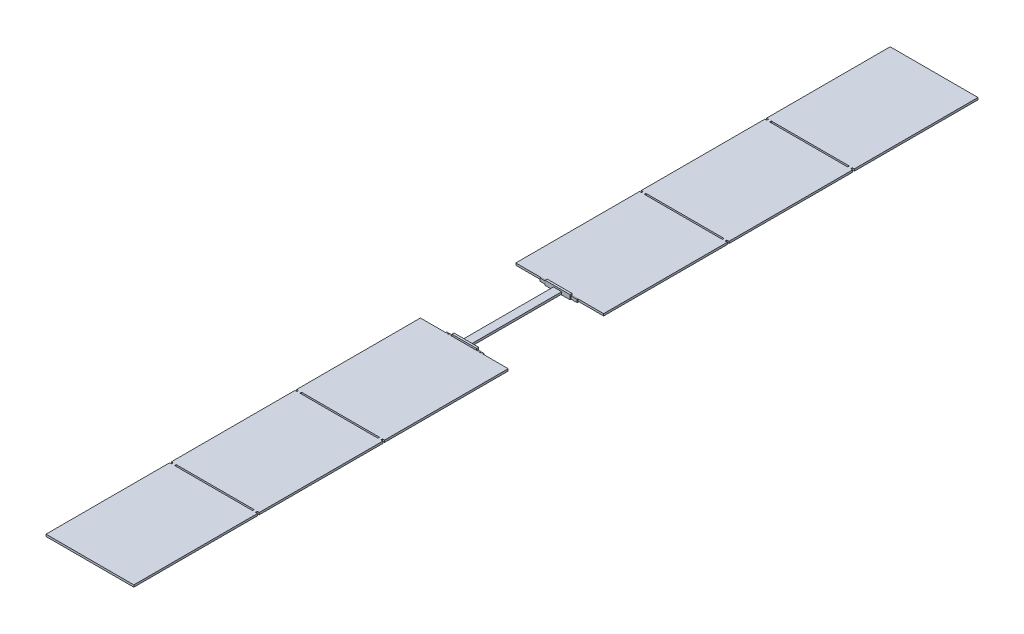
from build123d import *

# Parameters (mm, degrees)
ESTRUSIONE_ESTRUSIONE2_DEPTH      = 150
ESTRUSIONE_ESTRUSIONE2_DEPTH_BACK = 150
ESTRUSIONE_ESTRUSIONE3_DEPTH      = 3.3
ESTRUSIONE_ESTRUSIONE3_DEPTH_BACK = 303.3
SCHIZZO3_W                        = 6.5
SCHIZZO3_H                        = 6.5
SCHIZZO11_W                       = 60
SCHIZZO11_H                       = 4
ESTRUSIONE_ESTRUSIONE10_DEPTH     = 2.5
ESTRUSIONE_ESTRUSIONE11_DEPTH     = 2.5
ESTRUSIONE_ESTRUSIONE12_DEPTH     = 4.5
SCHIZZO13_W                       = 213
SCHIZZO13_H                       = 5
ESTRUSIONE_ESTRUSIONE13_DEPTH     = 300
SCHIZZO15_W                       = 7
SCHIZZO15_H                       = 5
ESTRUSIONE_ESTRUSIONE14_DEPTH     = 4
SCHIZZO16_W                       = 213
SCHIZZO16_H                       = 5
ESTRUSIONE_ESTRUSIONE15_DEPTH     = 300
RIPETIZIONE_A_L2_COUNT            = 2
RIPETIZIONE_A_L2_PITCH            = 304
SPECCHIA2_COPY_1_SKETCH_W         = 7
SPECCHIA2_COPY_1_SKETCH_H         = 5
SPECCHIA2_COPY_1_DEPTH            = 4
SPECCHIA2_COPY_2_SKETCH_W         = 213
SPECCHIA2_COPY_2_SKETCH_H         = 5
SPECCHIA2_COPY_2_DEPTH            = 300
SCHIZZO17_W                       = 83.15
SCHIZZO17_H                       = 226.3
TAGLIO_ESTRUSIONE1_DEPTH          = 404
SCHIZZO18_W                       = 226.3
SCHIZZO18_H                       = 7
SCHIZZO18_H_2                     = 282
TAGLIO_ESTRUSIONE2_DEPTH          = 404
SCHIZZO23_W                       = 221.3
SCHIZZO23_H                       = 4
SCHIZZO23_H_2                     = 1.75
TAGLIO_ESTRUSIONE7_DEPTH          = 404
SCHIZZO24_W                       = 20
SCHIZZO24_H                       = 221.3
TAGLIO_ESTRUSIONE8_DEPTH          = 404


with BuildPart() as part:
    # Schizzo2 → Estrusione-Estrusione2 (new, two sides: drawn at the far end of the back side and taken through both)
    with BuildSketch(Plane(origin=(0, 0, 0), x_dir=(1, 0, 0), z_dir=(0, 1, 0)).offset(-ESTRUSIONE_ESTRUSIONE2_DEPTH_BACK)):
        Polygon((-113.15, 106.65), (-113.15, -106.65), (-106.65, -106.65), (-106.65, -113.15), (106.65, -113.15), (106.65, -106.65), (113.15, -106.65), (113.15, 106.65), (106.65, 106.65), (106.65, 113.15), (-106.65, 113.15), (-106.65, 106.65), align=None)
    extrude(amount=ESTRUSIONE_ESTRUSIONE2_DEPTH + ESTRUSIONE_ESTRUSIONE2_DEPTH_BACK)

    # Schizzo3 → Estrusione-Estrusione3 (add, two sides: drawn at the far end of the back side and taken through both)
    with BuildSketch(Plane.XZ.offset(150).offset(-ESTRUSIONE_ESTRUSIONE3_DEPTH_BACK)):
        with Locations((-109.9, 109.9)):
            Rectangle(SCHIZZO3_W, SCHIZZO3_H)
        with Locations((109.9, 109.9)):
            Rectangle(SCHIZZO3_W, SCHIZZO3_H)
        with Locations((109.9, -109.9)):
            Rectangle(SCHIZZO3_W, SCHIZZO3_H)
        with Locations((-109.9, -109.9)):
            Rectangle(SCHIZZO3_W, SCHIZZO3_H)
    extrude(amount=ESTRUSIONE_ESTRUSIONE3_DEPTH + ESTRUSIONE_ESTRUSIONE3_DEPTH_BACK)

    # Schizzo11 → Estrusione-Estrusione10 (add)
    with BuildSketch(Plane(origin=(0, 0, -113.15), x_dir=(-1, 0, 0), z_dir=(0, 0, -1))):
        with Locations((0, 141)):
            Rectangle(SCHIZZO11_W, SCHIZZO11_H)
    estrusione_estrusione10 = extrude(amount=ESTRUSIONE_ESTRUSIONE10_DEPTH)

    # Schizzo11<5> → Estrusione-Estrusione11 (add)
    with BuildSketch(Plane(origin=(0, 0, -113.15), x_dir=(-1, 0, 0), z_dir=(0, 0, -1))):
        Polygon((30, 139), (-30, 139), (-45, 139), (-45, 135.5), (-43, 135.5), (-43, 133.75), (0, 133.75), (43, 133.75), (43, 135.5), (45, 135.5), (45, 139), align=None)
    estrusione_estrusione11 = extrude(amount=ESTRUSIONE_ESTRUSIONE11_DEPTH)

    # Schizzo11<8> → Estrusione-Estrusione12 (add)
    with BuildSketch(Plane(origin=(0, 0, -113.15), x_dir=(-1, 0, 0), z_dir=(0, 0, -1))):
        Polygon((-43, 135.5), (-45, 135.5), (-45, 132), (45, 132), (45, 135.5), (43, 135.5), (43, 133.75), (-43, 133.75), align=None)
    estrusione_estrusione12 = extrude(amount=ESTRUSIONE_ESTRUSIONE12_DEPTH)

    # Schizzo13 → Estrusione-Estrusione13 (add)
    with BuildSketch(Plane(origin=(0, 0, -115.65), x_dir=(-1, 0, 0), z_dir=(0, 0, -1))):
        with Locations((-0.15, 136.25)):
            Rectangle(SCHIZZO13_W, SCHIZZO13_H)
    estrusione_estrusione13 = extrude(amount=ESTRUSIONE_ESTRUSIONE13_DEPTH)

    # Schizzo15 → Estrusione-Estrusione14 (add)
    with BuildSketch(Plane(origin=(0, 0, -415.65), x_dir=(-1, 0, 0), z_dir=(0, 0, -1))):
        with Locations((-98.15, 136.25)):
            Rectangle(SCHIZZO15_W, SCHIZZO15_H)
        with Locations((98.15, 136.25)):
            Rectangle(SCHIZZO15_W, SCHIZZO15_H)
    estrusione_estrusione14 = extrude(amount=ESTRUSIONE_ESTRUSIONE14_DEPTH)

    # Schizzo16 → Estrusione-Estrusione15 (add)
    with BuildSketch(Plane(origin=(0, 0, -419.65), x_dir=(-1, 0, 0), z_dir=(0, 0, -1))):
        with Locations((-0.15, 136.25)):
            Rectangle(SCHIZZO16_W, SCHIZZO16_H)
    estrusione_estrusione15 = extrude(amount=ESTRUSIONE_ESTRUSIONE15_DEPTH)

    # Ripetizione a L2: Estrusione-Estrusione14, Estrusione-Estrusione15 ×2
    with Locations(*[(0, 0, -i * RIPETIZIONE_A_L2_PITCH) for i in range(1, RIPETIZIONE_A_L2_COUNT)]):
        add(estrusione_estrusione14)
        add(estrusione_estrusione15)

    # Specchia2: Estrusione-Estrusione10, Estrusione-Estrusione11, Estrusione-Estrusione12, Estrusione-Estrusione13, Estrusione-Estrusione14, Estrusione-Estrusione15 across plane
    add(estrusione_estrusione10.mirror(Plane.XY))
    add(estrusione_estrusione11.mirror(Plane.XY))
    add(estrusione_estrusione12.mirror(Plane.XY))
    add(estrusione_estrusione13.mirror(Plane.XY))
    add(estrusione_estrusione14.mirror(Plane.XY))
    add(estrusione_estrusione15.mirror(Plane.XY))

    # Specchia2 copy 1 sketch → Specchia2 copy 1 (add)
    with BuildSketch(Plane(origin=(0, 0, 719.65), x_dir=(-1, 0, 0), z_dir=(0, 0, 1))):
        with Locations((-98.15, -136.25)):
            Rectangle(SPECCHIA2_COPY_1_SKETCH_W, SPECCHIA2_COPY_1_SKETCH_H)
        with Locations((98.15, -136.25)):
            Rectangle(SPECCHIA2_COPY_1_SKETCH_W, SPECCHIA2_COPY_1_SKETCH_H)
    extrude(amount=SPECCHIA2_COPY_1_DEPTH)

    # Specchia2 copy 2 sketch → Specchia2 copy 2 (add)
    with BuildSketch(Plane(origin=(0, 0, 723.65), x_dir=(-1, 0, 0), z_dir=(0, 0, 1))):
        with Locations((-0.15, -136.25)):
            Rectangle(SPECCHIA2_COPY_2_SKETCH_W, SPECCHIA2_COPY_2_SKETCH_H)
    extrude(amount=SPECCHIA2_COPY_2_DEPTH)

    # Schizzo17 → Taglio-Estrusione1 (cut)
    with BuildSketch(Plane(origin=(0, 150, 0), x_dir=(1, 0, 0), z_dir=(0, 1, 0))):
        with Locations((-71.575, 0)):
            Rectangle(SCHIZZO17_W, SCHIZZO17_H)
        with Locations((71.575, 0)):
            Rectangle(SCHIZZO17_W, SCHIZZO17_H)
    extrude(amount=-TAGLIO_ESTRUSIONE1_DEPTH, mode=Mode.SUBTRACT)


with BuildPart() as taglio_estrusione1_piece_1:
    # of the separate pieces the step leaves, piece 1, a body of its own (taglio_estrusione1_pieces)
    add(part.part.solids().sort_by_distance((106.65, 138.75, 723.65))[0])

    # Schizzo18 → Taglio-Estrusione2 (cut)
    with BuildSketch(Plane(origin=(30, 0, 0), x_dir=(0, 0, -1), z_dir=(1, 0, 0))):
        with Locations((0, 146.5)):
            Rectangle(SCHIZZO18_W, SCHIZZO18_H)
        with Locations((0, -9)):
            Rectangle(SCHIZZO18_W, SCHIZZO18_H_2)
    extrude(amount=-TAGLIO_ESTRUSIONE2_DEPTH, mode=Mode.SUBTRACT)

    # Schizzo23 → Taglio-Estrusione7 (cut)
    with BuildSketch(Plane(origin=(30, 0, 0), x_dir=(0, 0, -1), z_dir=(1, 0, 0))):
        with Locations((0, 141)):
            Rectangle(SCHIZZO23_W, SCHIZZO23_H)
        with Locations((0, 132.875)):
            Rectangle(SCHIZZO23_W, SCHIZZO23_H_2)
    extrude(amount=-TAGLIO_ESTRUSIONE7_DEPTH, mode=Mode.SUBTRACT)

    # Schizzo24 → Taglio-Estrusione8 (cut)
    with BuildSketch(Plane(origin=(0, 139, 0), x_dir=(1, 0, 0), z_dir=(0, 1, 0))):
        with Locations((-20, 0)):
            Rectangle(SCHIZZO24_W, SCHIZZO24_H)
        with Locations((20, 0)):
            Rectangle(SCHIZZO24_W, SCHIZZO24_H)
    extrude(amount=-TAGLIO_ESTRUSIONE8_DEPTH, mode=Mode.SUBTRACT)


with BuildPart() as taglio_estrusione1_piece_2:
    # of the separate pieces the step leaves, piece 2, a body of its own (taglio_estrusione1_pieces)
    add(part.part.solids().sort_by_distance((-106.65, 150, 113.15))[0])


with BuildPart() as taglio_estrusione1_piece_3:
    # of the separate pieces the step leaves, piece 3, a body of its own (taglio_estrusione1_pieces)
    add(part.part.solids().sort_by_distance((-106.65, 150, -106.65))[0])


with BuildPart() as taglio_estrusione1_piece_4:
    # of the separate pieces the step leaves, piece 4, a body of its own (taglio_estrusione1_pieces)
    add(part.part.solids().sort_by_distance((113.15, 150, -106.65))[0])


with BuildPart() as taglio_estrusione1_piece_5:
    # of the separate pieces the step leaves, piece 5, a body of its own (taglio_estrusione1_pieces)
    add(part.part.solids().sort_by_distance((106.65, 150, 113.15))[0])


solid = taglio_estrusione1_piece_1.part
